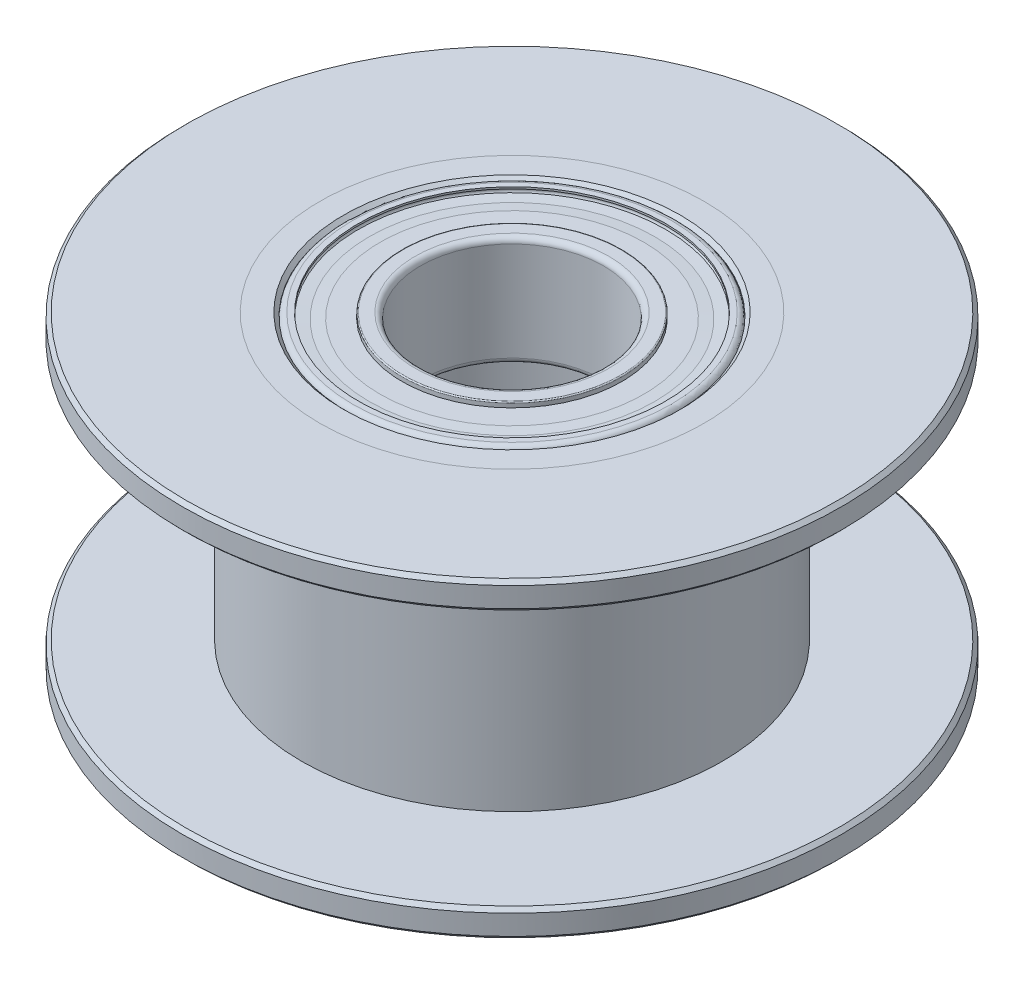
from build123d import *

# Parameters (mm, degrees)
ZKOSEN_1_SIZE            = 0.1
ZAOBLIT1_R               = 0.1
SKICA11_OUTSIDE_W        = 18.072
SKICA11_OUTSIDE_H        = 18.072
SKICA11_OUTSIDE_R        = 5.744420101
ODEBRAT_VYSUNUT_M1_DEPTH = 12.607183121
SKICA10_R                = 9
SKICA10_R_2              = 5.25
P_IDAT_VYSUNUT_M1_DEPTH  = 0.75
SKICA12_R                = 9
SKICA12_R_2              = 5.25
P_IDAT_VYSUNUT_M2_DEPTH  = 0.75
ZKOSEN_2_SIZE            = 0.1
ZKOSEN_3_SIZE            = 0.1
KRUHOV_POLE1_COUNT       = 8
KRUHOV_POLE3_COUNT       = 8


with BuildPart() as part:
    # Skica1 → Rotovat1 (revolve)
    with BuildSketch(Plane.XY, mode=Mode.PRIVATE) as rotovat1_sk:
        Polygon((4.5, 8.5), (5.25, 8.5), (5.25, 7.75), (6.11, 7.75), (6.11, 0.75), (5.25, 0.75), (5.25, 0), (4.5, 0), (4.5, 3), (3.5, 3), (3.5, 5.5), (4.5, 5.5), align=None)
    revolve(rotovat1_sk.sketch.rotate(Axis((0, 0, 0), (0, -1, 0)), 90), axis=Axis((0, 0, 0), (0, -1, 0)))

    # Zkosení1
    zkosen_1_edges = [part.edges().sort_by_distance(p)[0] for p in [
        (0, 3, -3.5),
        (0, 0, -4.5),
        (0, 8.5, -4.5),
        (0, 5.5, -3.5),
    ]]
    chamfer(zkosen_1_edges, length=ZKOSEN_1_SIZE)

    # Zaoblit1
    zaoblit1_edges = [part.edges().sort_by_distance(p)[0] for p in [
        (0, 3, -4.5),
        (0, 5.5, -4.5),
    ]]
    fillet(zaoblit1_edges, radius=ZAOBLIT1_R)

    # Skica11 outside → Odebrat vysunutím1 (cut, through all)
    with BuildSketch(Plane(origin=(0, 7.75, 0), x_dir=(1, 0, 0), z_dir=(0, 1, 0))):
        Rectangle(SKICA11_OUTSIDE_W, SKICA11_OUTSIDE_H)
        with Locations(Location((0, 0, 0), (0, 0, 270))):
            Circle(SKICA11_OUTSIDE_R, mode=Mode.SUBTRACT)
    extrude(amount=-ODEBRAT_VYSUNUT_M1_DEPTH, mode=Mode.SUBTRACT)


with BuildPart() as body_2:
    # Skica10 → Přidat vysunutím1 (new body)
    with BuildSketch(Plane(origin=(0, 8.5, 0), x_dir=(1, 0, 0), z_dir=(0, 1, 0))):
        with Locations(Location((0, 0, 0), (0, 0, 270))):
            Circle(SKICA10_R)
        with Locations(Location((0, 0, 0), (0, 0, 270))):
            Circle(SKICA10_R_2, mode=Mode.SUBTRACT)
    extrude(amount=-P_IDAT_VYSUNUT_M1_DEPTH)

    # Zkosení2
    zkosen_2_edges = [body_2.edges().sort_by_distance(p)[0] for p in [
        (0, 8.5, -9),
        (0, 7.75, -9),
    ]]
    chamfer(zkosen_2_edges, length=ZKOSEN_2_SIZE)


with BuildPart() as body_3:
    # Skica12 → Přidat vysunutím2 (new body)
    with BuildSketch(Plane.XZ):
        with Locations(Location((0, 0, 0), (0, 0, 270))):
            Circle(SKICA12_R)
        with Locations(Location((0, 0, 0), (0, 0, 270))):
            Circle(SKICA12_R_2, mode=Mode.SUBTRACT)
    extrude(amount=-P_IDAT_VYSUNUT_M2_DEPTH)

    # Zkosení3
    zkosen_3_edges = [body_3.edges().sort_by_distance(p)[0] for p in [
        (0, 0, 9),
        (0, 0.75, 9),
    ]]
    chamfer(zkosen_3_edges, length=ZKOSEN_3_SIZE)


with BuildPart() as body_4:
    # Skica4 → Rotovat2 (revolve)
    with BuildSketch(Plane.XY, mode=Mode.PRIVATE) as rotovat2_sk:
        with BuildLine():
            Line((4.5, 8.35), (4.5, 5.65))
            ThreePointArc((4.5, 5.65), (4.456066017, 5.543933983), (4.35, 5.5))
            Line((4.35, 5.5), (4.2, 5.5))
            Line((4.2, 5.5), (4.2, 5.55))
            ThreePointArc((4.2, 5.55), (4.289757174, 5.633393211), (4.213177928, 5.729030007))
            Line((4.213177928, 5.729030007), (3.85, 5.782786405))
            Line((3.85, 5.782786405), (3.85, 6.552786405))
            ThreePointArc((3.85, 6.552786405), (4.05, 7), (3.85, 7.447213595))
            Line((3.85, 7.447213595), (3.85, 8.217213595))
            Line((3.85, 8.217213595), (4.213177928, 8.270969993))
            ThreePointArc((4.213177928, 8.270969993), (4.289757174, 8.366606789), (4.2, 8.45))
            Line((4.2, 8.45), (4.2, 8.5))
            Line((4.2, 8.5), (4.35, 8.5))
            ThreePointArc((4.35, 8.5), (4.456066017, 8.456066017), (4.5, 8.35))
        make_face()
    revolve(rotovat2_sk.sketch.rotate(Axis((0, 0, 0), (0, 1, 0)), 90), axis=Axis((0, 0, 0), (0, 1, 0)))


with BuildPart() as body_5:
    # Skica5 → Rotovat3 (revolve)
    with BuildSketch(Plane.XY, mode=Mode.PRIVATE) as rotovat3_sk:
        with BuildLine():
            Line((2.5, 8.35), (2.5, 5.65))
            ThreePointArc((2.5, 5.65), (2.543933983, 5.543933983), (2.65, 5.5))
            Line((2.65, 5.5), (2.97, 5.5))
            ThreePointArc((2.97, 5.5), (2.991213203, 5.508786797), (3, 5.53))
            Line((3, 5.53), (3, 5.64))
            Line((3, 5.64), (3.6, 5.64))
            Line((3.6, 5.64), (3.896185034, 5.691714847))
            Line((3.896185034, 5.691714847), (4.192370069, 5.64))
            Line((4.192370069, 5.64), (4.192370069, 5.69))
            Line((4.192370069, 5.69), (3.897467562, 5.758062558))
            Line((3.897467562, 5.758062558), (3.597467562, 5.758062558))
            Line((3.597467562, 5.758062558), (3, 5.69))
            Line((3, 5.69), (3, 6.603137303))
            ThreePointArc((3, 6.603137303), (2.85, 7), (3, 7.396862697))
            Line((3, 7.396862697), (3, 8.31))
            Line((3, 8.31), (3.6, 8.27))
            Line((3.6, 8.27), (3.9, 8.27))
            Line((3.9, 8.27), (4.2, 8.31))
            Line((4.2, 8.31), (4.2, 8.36))
            Line((4.2, 8.36), (3.9, 8.34))
            Line((3.9, 8.34), (3.6, 8.36))
            Line((3.6, 8.36), (3, 8.36))
            Line((3, 8.36), (3, 8.47))
            ThreePointArc((3, 8.47), (2.991213203, 8.491213203), (2.97, 8.5))
            Line((2.97, 8.5), (2.65, 8.5))
            ThreePointArc((2.65, 8.5), (2.543933983, 8.456066017), (2.5, 8.35))
        make_face()
    revolve(rotovat3_sk.sketch.rotate(Axis((0, 0, 0), (0, 1, 0)), 90), axis=Axis((0, 0, 0), (0, 1, 0)))


with BuildPart() as body_6:
    # Skica6 → Rotovat4 (revolve)
    with BuildSketch(Plane.XY):
        with BuildLine():
            Line((3.45, 7.6), (3.45, 6.4))
            ThreePointArc((3.45, 6.4), (4.05, 7), (3.45, 7.6))
        make_face()
    revolve(axis=Axis((3.45, 7.6, 0), (0, -1, 0)))


with BuildPart() as kruhov_pole1_1:
    # Kruhové pole1: pattern copy
    add(body_6.part.rotate(Axis((0, 0, 0), (0, 1, 0)), 1 * 360 / KRUHOV_POLE1_COUNT))


with BuildPart() as kruhov_pole1_2:
    # Kruhové pole1: pattern copy
    add(body_6.part.rotate(Axis((0, 0, 0), (0, 1, 0)), 2 * 360 / KRUHOV_POLE1_COUNT))


with BuildPart() as kruhov_pole1_3:
    # Kruhové pole1: pattern copy
    add(body_6.part.rotate(Axis((0, 0, 0), (0, 1, 0)), 3 * 360 / KRUHOV_POLE1_COUNT))


with BuildPart() as kruhov_pole1_4:
    # Kruhové pole1: pattern copy
    add(body_6.part.rotate(Axis((0, 0, 0), (0, 1, 0)), 4 * 360 / KRUHOV_POLE1_COUNT))


with BuildPart() as kruhov_pole1_5:
    # Kruhové pole1: pattern copy
    add(body_6.part.rotate(Axis((0, 0, 0), (0, 1, 0)), 5 * 360 / KRUHOV_POLE1_COUNT))


with BuildPart() as kruhov_pole1_6:
    # Kruhové pole1: pattern copy
    add(body_6.part.rotate(Axis((0, 0, 0), (0, 1, 0)), 6 * 360 / KRUHOV_POLE1_COUNT))


with BuildPart() as kruhov_pole1_7:
    # Kruhové pole1: pattern copy
    add(body_6.part.rotate(Axis((0, 0, 0), (0, 1, 0)), 7 * 360 / KRUHOV_POLE1_COUNT))


with BuildPart() as body_14:
    # Skica7 → Rotovat5 (revolve)
    with BuildSketch(Plane.XY, mode=Mode.PRIVATE) as rotovat5_sk:
        with BuildLine():
            Line((4.5, 2.85), (4.5, 0.15))
            ThreePointArc((4.5, 0.15), (4.456066017, 0.043933983), (4.35, 0))
            Line((4.35, 0), (4.2, 0))
            Line((4.2, 0), (4.2, 0.05))
            ThreePointArc((4.2, 0.05), (4.289757174, 0.133393211), (4.213177928, 0.229030007))
            Line((4.213177928, 0.229030007), (3.85, 0.282786405))
            Line((3.85, 0.282786405), (3.85, 1.052786405))
            ThreePointArc((3.85, 1.052786405), (4.05, 1.5), (3.85, 1.947213595))
            Line((3.85, 1.947213595), (3.85, 2.717213595))
            Line((3.85, 2.717213595), (4.213177928, 2.770969993))
            ThreePointArc((4.213177928, 2.770969993), (4.289757174, 2.866606789), (4.2, 2.95))
            Line((4.2, 2.95), (4.2, 3))
            Line((4.2, 3), (4.35, 3))
            ThreePointArc((4.35, 3), (4.456066017, 2.956066017), (4.5, 2.85))
        make_face()
    revolve(rotovat5_sk.sketch.rotate(Axis((0, 0, 0), (0, 1, 0)), 90), axis=Axis((0, 0, 0), (0, 1, 0)))


with BuildPart() as body_15:
    # Skica8 → Rotovat6 (revolve)
    with BuildSketch(Plane.XY, mode=Mode.PRIVATE) as rotovat6_sk:
        with BuildLine():
            Line((2.5, 2.85), (2.5, 0.15))
            ThreePointArc((2.5, 0.15), (2.543933983, 0.043933983), (2.65, 0))
            Line((2.65, 0), (2.97, 0))
            ThreePointArc((2.97, 0), (2.991213203, 0.008786797), (3, 0.03))
            Line((3, 0.03), (3, 0.14))
            Line((3, 0.14), (3.6, 0.14))
            Line((3.6, 0.14), (3.896185034, 0.191714847))
            Line((3.896185034, 0.191714847), (4.192370069, 0.14))
            Line((4.192370069, 0.14), (4.192370069, 0.19))
            Line((4.192370069, 0.19), (3.897467562, 0.258062558))
            Line((3.897467562, 0.258062558), (3.597467562, 0.258062558))
            Line((3.597467562, 0.258062558), (3, 0.19))
            Line((3, 0.19), (3, 1.103137303))
            ThreePointArc((3, 1.103137303), (2.85, 1.5), (3, 1.896862697))
            Line((3, 1.896862697), (3, 2.81))
            Line((3, 2.81), (3.6, 2.77))
            Line((3.6, 2.77), (3.9, 2.77))
            Line((3.9, 2.77), (4.2, 2.81))
            Line((4.2, 2.81), (4.2, 2.86))
            Line((4.2, 2.86), (3.9, 2.84))
            Line((3.9, 2.84), (3.6, 2.86))
            Line((3.6, 2.86), (3, 2.86))
            Line((3, 2.86), (3, 2.97))
            ThreePointArc((3, 2.97), (2.991213203, 2.991213203), (2.97, 3))
            Line((2.97, 3), (2.65, 3))
            ThreePointArc((2.65, 3), (2.543933983, 2.956066017), (2.5, 2.85))
        make_face()
    revolve(rotovat6_sk.sketch.rotate(Axis((0, 0, 0), (0, -1, 0)), 180), axis=Axis((0, 0, 0), (0, -1, 0)))


with BuildPart() as body_16:
    # Skica9 → Rotovat7 (revolve)
    with BuildSketch(Plane.XY):
        with BuildLine():
            Line((3.45, 2.1), (3.45, 0.9))
            ThreePointArc((3.45, 0.9), (4.05, 1.5), (3.45, 2.1))
        make_face()
    revolve(axis=Axis((3.45, 2.1, 0), (0, -1, 0)))


with BuildPart() as kruhov_pole3_1:
    # Kruhové pole3: pattern copy
    add(body_16.part.rotate(Axis((0, 0, 0), (0, 1, 0)), 1 * 360 / KRUHOV_POLE3_COUNT))


with BuildPart() as kruhov_pole3_2:
    # Kruhové pole3: pattern copy
    add(body_16.part.rotate(Axis((0, 0, 0), (0, 1, 0)), 2 * 360 / KRUHOV_POLE3_COUNT))


with BuildPart() as kruhov_pole3_3:
    # Kruhové pole3: pattern copy
    add(body_16.part.rotate(Axis((0, 0, 0), (0, 1, 0)), 3 * 360 / KRUHOV_POLE3_COUNT))


with BuildPart() as kruhov_pole3_4:
    # Kruhové pole3: pattern copy
    add(body_16.part.rotate(Axis((0, 0, 0), (0, 1, 0)), 4 * 360 / KRUHOV_POLE3_COUNT))


with BuildPart() as kruhov_pole3_5:
    # Kruhové pole3: pattern copy
    add(body_16.part.rotate(Axis((0, 0, 0), (0, 1, 0)), 5 * 360 / KRUHOV_POLE3_COUNT))


with BuildPart() as kruhov_pole3_6:
    # Kruhové pole3: pattern copy
    add(body_16.part.rotate(Axis((0, 0, 0), (0, 1, 0)), 6 * 360 / KRUHOV_POLE3_COUNT))


with BuildPart() as kruhov_pole3_7:
    # Kruhové pole3: pattern copy
    add(body_16.part.rotate(Axis((0, 0, 0), (0, 1, 0)), 7 * 360 / KRUHOV_POLE3_COUNT))


solid = Compound([part.part, body_2.part, body_3.part, body_4.part, body_5.part, body_6.part, kruhov_pole1_1.part, kruhov_pole1_2.part, kruhov_pole1_3.part, kruhov_pole1_4.part, kruhov_pole1_5.part, kruhov_pole1_6.part, kruhov_pole1_7.part, body_14.part, body_15.part, body_16.part, kruhov_pole3_1.part, kruhov_pole3_2.part, kruhov_pole3_3.part, kruhov_pole3_4.part, kruhov_pole3_5.part, kruhov_pole3_6.part, kruhov_pole3_7.part])
